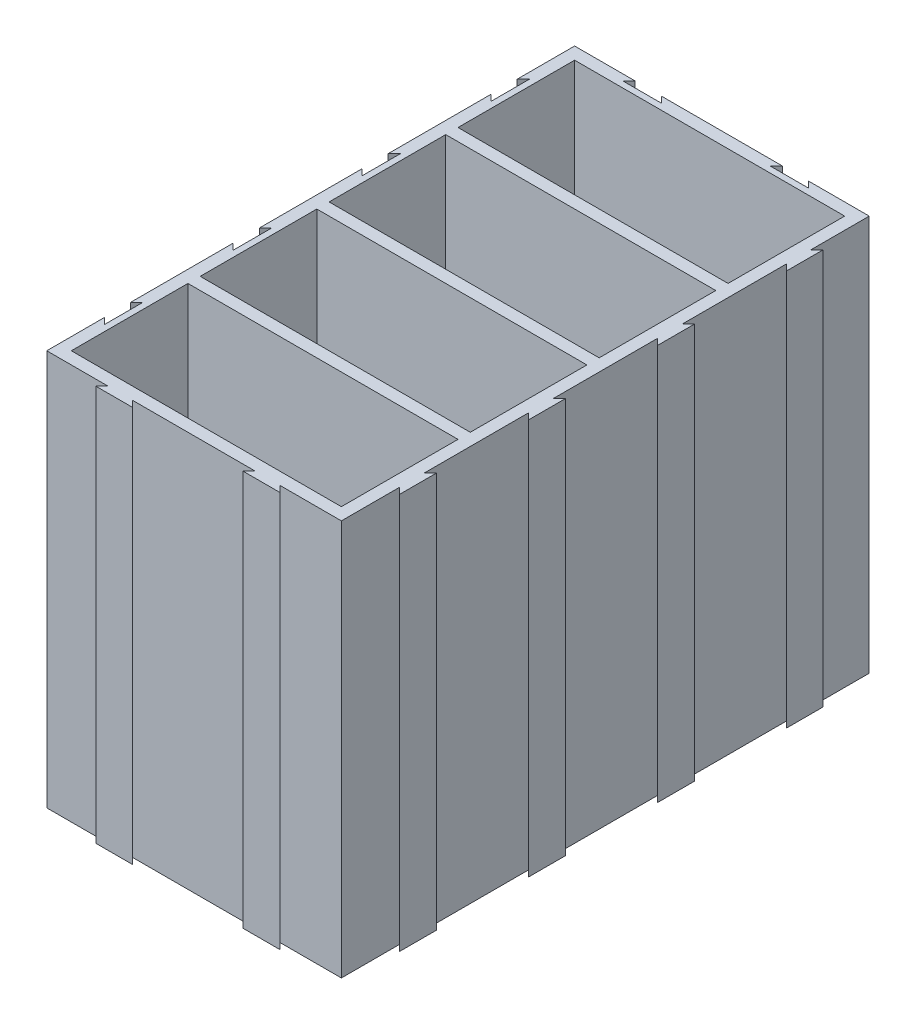
from build123d import *

# Parameters (mm, degrees)
EXTRUDE_1_DEPTH = 1.6
EXTRUDE_START   = 1.6
EXTRUDE_2_DEPTH = 50


with BuildPart() as part:
    # Эскиз1 → Бобышка-Вытянуть1 (new body)
    with BuildSketch(Plane(origin=(0, 0, 0), x_dir=(1, 0, 0), z_dir=(0, 1, 0))):
        Polygon((-19.2, 34.4), (-19.2, 26.9), (-18.4, 27.7), (-18.4, 22.7), (-19.2, 23.5), (-19.2, 10.1), (-18.4, 10.9), (-18.4, 5.9), (-19.2, 6.7), (-19.2, -6.7), (-18.4, -5.9), (-18.4, -10.9), (-19.2, -10.1), (-19.2, -23.5), (-18.4, -22.7), (-18.4, -27.7), (-19.2, -26.9), (-19.2, -34.4), (-11.2, -34.4), (-12, -35.2), (-7.2, -35.2), (-8, -34.4), (8, -34.4), (7.2, -35.2), (12, -35.2), (11.2, -34.4), (19.2, -34.4), (19.2, -26.8), (20, -27.6), (20, -22.8), (19.2, -23.6), (19.2, -10), (20, -10.8), (20, -6), (19.2, -6.8), (19.2, 6.8), (20, 6), (20, 10.8), (19.2, 10), (19.2, 23.6), (20, 22.8), (20, 27.6), (19.2, 26.8), (19.2, 34.4), (11.3, 34.4), (12.1, 33.6), (7.1, 33.6), (7.9, 34.4), (-7.9, 34.4), (-7.1, 33.6), (-12.1, 33.6), (-11.3, 34.4), align=None)
        with BuildLine():
            ThreePointArc((-16.6, 0.8), (-17.307106781, 1.092893219), (-17.6, 1.8))
            Line((-17.6, 1.8), (-17.6, 4.9))
            ThreePointArc((-17.6, 4.9), (-17.307106781, 5.607106781), (-16.6, 5.9))
            Line((-16.6, 5.9), (-3.5, 5.9))
            ThreePointArc((-3.5, 5.9), (-2.792893219, 5.607106781), (-2.5, 4.9))
            Line((-2.5, 4.9), (-2.5, 1.8))
            ThreePointArc((-2.5, 1.8), (-2.792893219, 1.092893219), (-3.5, 0.8))
            Line((-3.5, 0.8), (-16.6, 0.8))
        make_face(mode=Mode.SUBTRACT)
        with BuildLine():
            Line((-3.5, -32.8), (-16.6, -32.8))
            ThreePointArc((-16.6, -32.8), (-17.307106781, -32.507106781), (-17.6, -31.8))
            Line((-17.6, -31.8), (-17.6, -28.7))
            ThreePointArc((-17.6, -28.7), (-17.307106781, -27.992893219), (-16.6, -27.7))
            Line((-16.6, -27.7), (-3.5, -27.7))
            ThreePointArc((-3.5, -27.7), (-2.792893219, -27.992893219), (-2.5, -28.7))
            Line((-2.5, -28.7), (-2.5, -31.8))
            ThreePointArc((-2.5, -31.8), (-2.792893219, -32.507106781), (-3.5, -32.8))
        make_face(mode=Mode.SUBTRACT)
        with BuildLine():
            Line((16.6, -32.8), (3.5, -32.8))
            ThreePointArc((3.5, -32.8), (2.792893219, -32.507106781), (2.5, -31.8))
            Line((2.5, -31.8), (2.5, -28.7))
            ThreePointArc((2.5, -28.7), (2.792893219, -27.992893219), (3.5, -27.7))
            Line((3.5, -27.7), (16.6, -27.7))
            ThreePointArc((16.6, -27.7), (17.307106781, -27.992893219), (17.6, -28.7))
            Line((17.6, -28.7), (17.6, -31.8))
            ThreePointArc((17.6, -31.8), (17.307106781, -32.507106781), (16.6, -32.8))
        make_face(mode=Mode.SUBTRACT)
        with BuildLine():
            Line((17.6, -18.6), (17.6, -21.7))
            ThreePointArc((17.6, -21.7), (17.307106781, -22.407106781), (16.6, -22.7))
            Line((16.6, -22.7), (3.5, -22.7))
            ThreePointArc((3.5, -22.7), (2.792893219, -22.407106781), (2.5, -21.7))
            Line((2.5, -21.7), (2.5, -18.6))
            ThreePointArc((2.5, -18.6), (2.792893219, -17.892893219), (3.5, -17.6))
            Line((3.5, -17.6), (16.6, -17.6))
            ThreePointArc((16.6, -17.6), (17.307106781, -17.892893219), (17.6, -18.6))
        make_face(mode=Mode.SUBTRACT)
        with BuildLine():
            Line((-16.6, -17.6), (-3.5, -17.6))
            ThreePointArc((-3.5, -17.6), (-2.792893219, -17.892893219), (-2.5, -18.6))
            Line((-2.5, -18.6), (-2.5, -21.7))
            ThreePointArc((-2.5, -21.7), (-2.792893219, -22.407106781), (-3.5, -22.7))
            Line((-3.5, -22.7), (-16.6, -22.7))
            ThreePointArc((-16.6, -22.7), (-17.307106781, -22.407106781), (-17.6, -21.7))
            Line((-17.6, -21.7), (-17.6, -18.6))
            ThreePointArc((-17.6, -18.6), (-17.307106781, -17.892893219), (-16.6, -17.6))
        make_face(mode=Mode.SUBTRACT)
        with BuildLine():
            Line((-3.5, -16), (-16.6, -16))
            ThreePointArc((-16.6, -16), (-17.307106781, -15.707106781), (-17.6, -15))
            Line((-17.6, -15), (-17.6, -11.9))
            ThreePointArc((-17.6, -11.9), (-17.307106781, -11.192893219), (-16.6, -10.9))
            Line((-16.6, -10.9), (-3.5, -10.9))
            ThreePointArc((-3.5, -10.9), (-2.792893219, -11.192893219), (-2.5, -11.9))
            Line((-2.5, -11.9), (-2.5, -15))
            ThreePointArc((-2.5, -15), (-2.792893219, -15.707106781), (-3.5, -16))
        make_face(mode=Mode.SUBTRACT)
        with BuildLine():
            Line((16.6, -16), (3.5, -16))
            ThreePointArc((3.5, -16), (2.792893219, -15.707106781), (2.5, -15))
            Line((2.5, -15), (2.5, -11.9))
            ThreePointArc((2.5, -11.9), (2.792893219, -11.192893219), (3.5, -10.9))
            Line((3.5, -10.9), (16.6, -10.9))
            ThreePointArc((16.6, -10.9), (17.307106781, -11.192893219), (17.6, -11.9))
            Line((17.6, -11.9), (17.6, -15))
            ThreePointArc((17.6, -15), (17.307106781, -15.707106781), (16.6, -16))
        make_face(mode=Mode.SUBTRACT)
        with BuildLine():
            Line((17.6, -1.8), (17.6, -4.9))
            ThreePointArc((17.6, -4.9), (17.307106781, -5.607106781), (16.6, -5.9))
            Line((16.6, -5.9), (3.5, -5.9))
            ThreePointArc((3.5, -5.9), (2.792893219, -5.607106781), (2.5, -4.9))
            Line((2.5, -4.9), (2.5, -1.8))
            ThreePointArc((2.5, -1.8), (2.792893219, -1.092893219), (3.5, -0.8))
            Line((3.5, -0.8), (16.6, -0.8))
            ThreePointArc((16.6, -0.8), (17.307106781, -1.092893219), (17.6, -1.8))
        make_face(mode=Mode.SUBTRACT)
        with BuildLine():
            Line((-16.6, -0.8), (-3.5, -0.8))
            ThreePointArc((-3.5, -0.8), (-2.792893219, -1.092893219), (-2.5, -1.8))
            Line((-2.5, -1.8), (-2.5, -4.9))
            ThreePointArc((-2.5, -4.9), (-2.792893219, -5.607106781), (-3.5, -5.9))
            Line((-3.5, -5.9), (-16.6, -5.9))
            ThreePointArc((-16.6, -5.9), (-17.307106781, -5.607106781), (-17.6, -4.9))
            Line((-17.6, -4.9), (-17.6, -1.8))
            ThreePointArc((-17.6, -1.8), (-17.307106781, -1.092893219), (-16.6, -0.8))
        make_face(mode=Mode.SUBTRACT)
        with BuildLine():
            Line((-17.6, 18.6), (-17.6, 21.7))
            ThreePointArc((-17.6, 21.7), (-17.307106781, 22.407106781), (-16.6, 22.7))
            Line((-16.6, 22.7), (-3.5, 22.7))
            ThreePointArc((-3.5, 22.7), (-2.792893219, 22.407106781), (-2.5, 21.7))
            Line((-2.5, 21.7), (-2.5, 18.6))
            ThreePointArc((-2.5, 18.6), (-2.792893219, 17.892893219), (-3.5, 17.6))
            Line((-3.5, 17.6), (-16.6, 17.6))
            ThreePointArc((-16.6, 17.6), (-17.307106781, 17.892893219), (-17.6, 18.6))
        make_face(mode=Mode.SUBTRACT)
        with BuildLine():
            Line((16.6, 0.8), (3.5, 0.8))
            ThreePointArc((3.5, 0.8), (2.792893219, 1.092893219), (2.5, 1.8))
            Line((2.5, 1.8), (2.5, 4.9))
            ThreePointArc((2.5, 4.9), (2.792893219, 5.607106781), (3.5, 5.9))
            Line((3.5, 5.9), (16.6, 5.9))
            ThreePointArc((16.6, 5.9), (17.307106781, 5.607106781), (17.6, 4.9))
            Line((17.6, 4.9), (17.6, 1.8))
            ThreePointArc((17.6, 1.8), (17.307106781, 1.092893219), (16.6, 0.8))
        make_face(mode=Mode.SUBTRACT)
        with BuildLine():
            Line((17.6, 15), (17.6, 11.9))
            ThreePointArc((17.6, 11.9), (17.307106781, 11.192893219), (16.6, 10.9))
            Line((16.6, 10.9), (3.5, 10.9))
            ThreePointArc((3.5, 10.9), (2.792893219, 11.192893219), (2.5, 11.9))
            Line((2.5, 11.9), (2.5, 15))
            ThreePointArc((2.5, 15), (2.792893219, 15.707106781), (3.5, 16))
            Line((3.5, 16), (16.6, 16))
            ThreePointArc((16.6, 16), (17.307106781, 15.707106781), (17.6, 15))
        make_face(mode=Mode.SUBTRACT)
        with BuildLine():
            Line((-16.6, 16), (-3.5, 16))
            ThreePointArc((-3.5, 16), (-2.792893219, 15.707106781), (-2.5, 15))
            Line((-2.5, 15), (-2.5, 11.9))
            ThreePointArc((-2.5, 11.9), (-2.792893219, 11.192893219), (-3.5, 10.9))
            Line((-3.5, 10.9), (-16.6, 10.9))
            ThreePointArc((-16.6, 10.9), (-17.307106781, 11.192893219), (-17.6, 11.9))
            Line((-17.6, 11.9), (-17.6, 15))
            ThreePointArc((-17.6, 15), (-17.307106781, 15.707106781), (-16.6, 16))
        make_face(mode=Mode.SUBTRACT)
        with BuildLine():
            Line((16.6, 17.6), (3.5, 17.6))
            ThreePointArc((3.5, 17.6), (2.792893219, 17.892893219), (2.5, 18.6))
            Line((2.5, 18.6), (2.5, 21.7))
            ThreePointArc((2.5, 21.7), (2.792893219, 22.407106781), (3.5, 22.7))
            Line((3.5, 22.7), (16.6, 22.7))
            ThreePointArc((16.6, 22.7), (17.307106781, 22.407106781), (17.6, 21.7))
            Line((17.6, 21.7), (17.6, 18.6))
            ThreePointArc((17.6, 18.6), (17.307106781, 17.892893219), (16.6, 17.6))
        make_face(mode=Mode.SUBTRACT)
        with BuildLine():
            Line((17.6, 31.8), (17.6, 28.7))
            ThreePointArc((17.6, 28.7), (17.307106781, 27.992893219), (16.6, 27.7))
            Line((16.6, 27.7), (3.5, 27.7))
            ThreePointArc((3.5, 27.7), (2.792893219, 27.992893219), (2.5, 28.7))
            Line((2.5, 28.7), (2.5, 31.8))
            ThreePointArc((2.5, 31.8), (2.792893219, 32.507106781), (3.5, 32.8))
            Line((3.5, 32.8), (16.6, 32.8))
            ThreePointArc((16.6, 32.8), (17.307106781, 32.507106781), (17.6, 31.8))
        make_face(mode=Mode.SUBTRACT)
        with BuildLine():
            Line((-16.6, 32.8), (-3.5, 32.8))
            ThreePointArc((-3.5, 32.8), (-2.792893219, 32.507106781), (-2.5, 31.8))
            Line((-2.5, 31.8), (-2.5, 28.7))
            ThreePointArc((-2.5, 28.7), (-2.792893219, 27.992893219), (-3.5, 27.7))
            Line((-3.5, 27.7), (-16.6, 27.7))
            ThreePointArc((-16.6, 27.7), (-17.307106781, 27.992893219), (-17.6, 28.7))
            Line((-17.6, 28.7), (-17.6, 31.8))
            ThreePointArc((-17.6, 31.8), (-17.307106781, 32.507106781), (-16.6, 32.8))
        make_face(mode=Mode.SUBTRACT)
    extrude(amount=EXTRUDE_1_DEPTH)

    # Эскиз1<3> → Бобышка-Вытянуть2 (add)
    with BuildSketch(Plane(origin=(0, 0, 0), x_dir=(1, 0, 0), z_dir=(0, 1, 0)).offset(EXTRUDE_START)):
        Polygon((-19.2, 34.4), (-19.2, 26.9), (-18.4, 27.7), (-18.4, 22.7), (-19.2, 23.5), (-19.2, 10.1), (-18.4, 10.9), (-18.4, 5.9), (-19.2, 6.7), (-19.2, -6.7), (-18.4, -5.9), (-18.4, -10.9), (-19.2, -10.1), (-19.2, -23.5), (-18.4, -22.7), (-18.4, -27.7), (-19.2, -26.9), (-19.2, -34.4), (-11.2, -34.4), (-12, -35.2), (-7.2, -35.2), (-8, -34.4), (8, -34.4), (7.2, -35.2), (12, -35.2), (11.2, -34.4), (19.2, -34.4), (19.2, -26.8), (20, -27.6), (20, -22.8), (19.2, -23.6), (19.2, -10), (20, -10.8), (20, -6), (19.2, -6.8), (19.2, 6.8), (20, 6), (20, 10.8), (19.2, 10), (19.2, 23.6), (20, 22.8), (20, 27.6), (19.2, 26.8), (19.2, 34.4), (11.3, 34.4), (12.1, 33.6), (7.1, 33.6), (7.9, 34.4), (-7.9, 34.4), (-7.1, 33.6), (-12.1, 33.6), (-11.3, 34.4), align=None)
        Polygon((-16.6, -32.8), (-17.6, -32.8), (-17.6, -31.8), (-17.6, -28.7), (-17.6, -21.7), (-17.6, -18.6), (-17.6, -17.6), (-16.6, -17.6), (-3.5, -17.6), (3.5, -17.6), (16.6, -17.6), (17.6, -17.6), (17.6, -18.6), (17.6, -21.7), (17.6, -28.7), (17.6, -31.8), (17.6, -32.8), (16.6, -32.8), (3.5, -32.8), (-3.5, -32.8), align=None, mode=Mode.SUBTRACT)
        Polygon((-16.6, -16), (-17.6, -16), (-17.6, -15), (-17.6, -11.9), (-17.6, -4.9), (-17.6, -1.8), (-17.6, -0.8), (-16.6, -0.8), (-3.5, -0.8), (3.5, -0.8), (16.6, -0.8), (17.6, -0.8), (17.6, -1.8), (17.6, -4.9), (17.6, -11.9), (17.6, -15), (17.6, -16), (16.6, -16), (3.5, -16), (-3.5, -16), align=None, mode=Mode.SUBTRACT)
        Polygon((-16.6, 0.8), (-17.6, 0.8), (-17.6, 1.8), (-17.6, 4.9), (-17.6, 11.9), (-17.6, 15), (-17.6, 16), (-16.6, 16), (-3.5, 16), (3.5, 16), (16.6, 16), (17.6, 16), (17.6, 15), (17.6, 11.9), (17.6, 4.9), (17.6, 1.8), (17.6, 0.8), (16.6, 0.8), (3.5, 0.8), (-3.5, 0.8), align=None, mode=Mode.SUBTRACT)
        Polygon((-16.6, 17.6), (-17.6, 17.6), (-17.6, 18.6), (-17.6, 21.7), (-17.6, 28.7), (-17.6, 31.8), (-17.6, 32.8), (-16.6, 32.8), (-3.5, 32.8), (3.5, 32.8), (16.6, 32.8), (17.6, 32.8), (17.6, 31.8), (17.6, 28.7), (17.6, 21.7), (17.6, 18.6), (17.6, 17.6), (16.6, 17.6), (3.5, 17.6), (-3.5, 17.6), align=None, mode=Mode.SUBTRACT)
    extrude(amount=EXTRUDE_2_DEPTH)


solid = part.part
